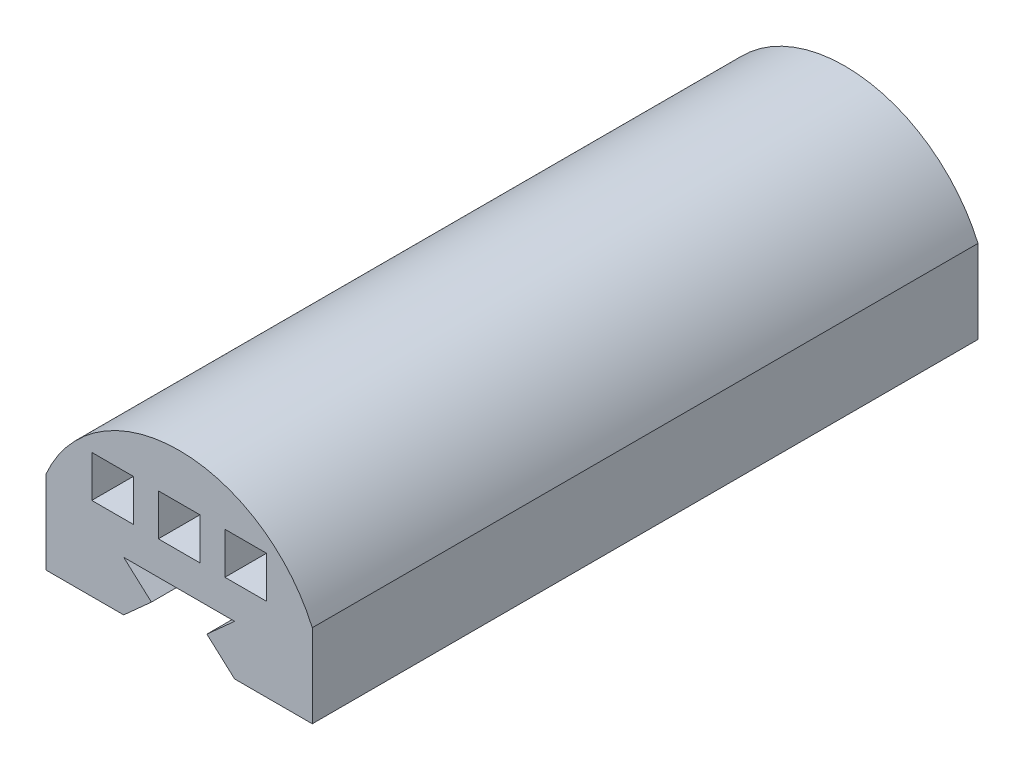
from build123d import *

# Parameters (mm, degrees)
SKETCH1_W           = 20.32
SKETCH1_H           = 50.8
BOSS_EXTRUDE1_DEPTH = 19.05
CUT_EXTRUDE1_DEPTH  = 50.8
SKETCH5_W           = 3.175
SKETCH5_H           = 3.175
CUT_EXTRUDE2_DEPTH  = 50.8


with BuildPart() as part:
    # Sketch1 → Boss-Extrude1 (new body)
    with BuildSketch(Plane(origin=(0, 0, 0), x_dir=(1, 0, 0), z_dir=(0, 1, 0))):
        Rectangle(SKETCH1_W, SKETCH1_H)
    extrude(amount=BOSS_EXTRUDE1_DEPTH)

    # Sketch3 → Cut-Extrude1 (cut)
    with BuildSketch(Plane.XY.offset(25.4)):
        Polygon((-4.233333333, 3.81), (4.233333333, 3.81), (2.116666667, 1.905), (4.233333333, 0), (-4.233333333, 0), (-2.116666667, 1.905), align=None)
    extrude(amount=-CUT_EXTRUDE1_DEPTH, mode=Mode.SUBTRACT)

    # Sketch4 → Revolve1 (revolve)
    with BuildSketch(Plane.XZ.offset(-3.81)):
        with BuildLine():
            Line((0, 4.7413418), (0, 3.4713418))
            ThreePointArc((0, 3.4713418), (0.635, 4.1063418), (0, 4.7413418))
        make_face()
    revolve(axis=Axis((0, 3.81, -25.4), (0, 0, 1)))

    # Sketch5 → Cut-Extrude2 (cut)
    with BuildSketch(Plane.XY.offset(25.4)):
        with BuildLine():
            Line((-10.16, 6.35), (-10.16, 19.05))
            Line((-10.16, 19.05), (10.16, 19.05))
            Line((10.16, 19.05), (10.16, 6.35))
            ThreePointArc((10.16, 6.35), (0, 12.99479824), (-10.16, 6.35))
        make_face()
        with Locations((0, 7.9375)):
            Rectangle(SKETCH5_W, SKETCH5_H)
        with Locations((-5.08, 7.9375)):
            Rectangle(SKETCH5_W, SKETCH5_H)
        with Locations((5.08, 7.9375)):
            Rectangle(SKETCH5_W, SKETCH5_H)
    extrude(amount=-CUT_EXTRUDE2_DEPTH, mode=Mode.SUBTRACT)


solid = part.part
